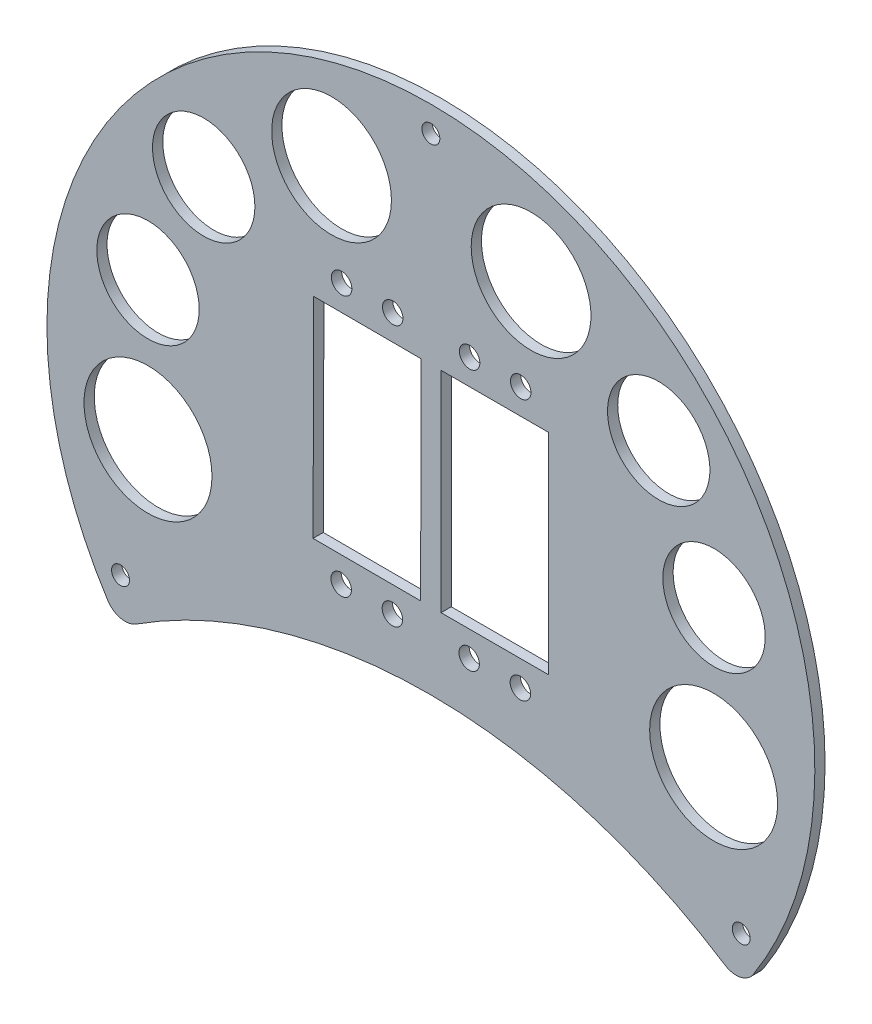
from build123d import *

# Parameters (mm, degrees)
EPAISSEUR_PLAQUE_DEPTH          = 2
ESQUISSE5_R                     = 1.75
PERCAGE_FIS_FIXATIONS_DEPTH     = 2
ARRONDIS_EXTREMITES_R           = 4
ESQUISSE10_R                    = 10
ESQUISSE10_R_2                  = 12.5
ESQUISSE10_R_3                  = 11.697835519
EVIDEMENT_DE_MATI_RE_DEPTH      = 2
ESQUISSE11_W                    = 21
ESQUISSE11_H                    = 41
ESQUISSE11_R                    = 2
EMPLACEMENTS_SERVOMOTEURS_DEPTH = 10


with BuildPart() as part:
    # Esquisse3 → Epaisseur plaque (new body)
    with BuildSketch(Plane.XY):
        with BuildLine():
            ThreePointArc((60.676831069, -44.083127967), (0.112789047, 74.999915191), (-60.809145642, -43.900430594))
            ThreePointArc((-60.809145642, -43.900430594), (-0.037511568, -24.943596323), (60.676831069, -44.083127967))
        make_face()
    extrude(amount=EPAISSEUR_PLAQUE_DEPTH)

    # Esquisse5 → Percage fis fixations (cut)
    with BuildSketch(Plane.XY.offset(2)):
        with Locations((0, 70)):
            Circle(ESQUISSE5_R)
        with Locations((60.621778265, -35)):
            Circle(ESQUISSE5_R)
        with Locations((-60.621778265, -35)):
            Circle(ESQUISSE5_R)
    extrude(amount=-PERCAGE_FIS_FIXATIONS_DEPTH, mode=Mode.SUBTRACT)

    # Arrondis extremites
    arrondis_extremites_edges = [part.edges().sort_by_distance(p)[0] for p in [
        (-60.809145642, -43.900430594, 1),
        (60.676831069, -44.083127967, 1),
    ]]
    fillet(arrondis_extremites_edges, radius=ARRONDIS_EXTREMITES_R)

    # Esquisse10 → Evidement de matière (cut)
    with BuildSketch(Plane.XY.offset(2)):
        with Locations((-44.375477733, 40.460370332)):
            Circle(ESQUISSE10_R)
        with Locations((-55.259118801, 17.647943075)):
            Circle(ESQUISSE10_R)
        with Locations((-55.259118801, -9.36594672)):
            Circle(ESQUISSE10_R_2)
        with Locations(Location((55.230698855, -9.532107458, 0), (0, 0, 180))):
            Circle(ESQUISSE10_R_2)
        with Locations(Location((55.311948653, 17.481660149, 0), (0, 0, 180))):
            Circle(ESQUISSE10_R)
        with Locations(Location((44.496969854, 40.326718999, 0), (0, 0, 180))):
            Circle(ESQUISSE10_R)
        with Locations((-19.404495621, 54.872818382)):
            Circle(ESQUISSE10_R_3)
        with Locations(Location((19.569449075, 54.814207195, 0), (0, 0, 180))):
            Circle(ESQUISSE10_R_3)
    extrude(amount=-EVIDEMENT_DE_MATI_RE_DEPTH, mode=Mode.SUBTRACT)

    # Esquisse11 → Emplacements servomoteurs (cut)
    with BuildSketch(Plane.XY.offset(2)):
        Polygon((-1.891789392, 30.96484727), (-2.015105277, -10.03496728), (-23.015010291, -9.971805486), (-22.891694406, 31.028009065), align=None)
        with Locations((12.484913946, 10.459017268)):
            Rectangle(ESQUISSE11_W, ESQUISSE11_H)
        with Locations((7.56186672, 35.974032472)):
            Circle(ESQUISSE11_R)
        with Locations((17.546338474, 35.959017268)):
            Circle(ESQUISSE11_R)
        with Locations((-7.453633256, 35.996613617)):
            Circle(ESQUISSE11_R)
        with Locations((-17.438105011, 36.011628821)):
            Circle(ESQUISSE11_R)
        with Locations((-17.522560101, -14.988347843)):
            Circle(ESQUISSE11_R)
        with Locations((17.477400322, -15.040982732)):
            Circle(ESQUISSE11_R)
        with Locations((7.47741163, -15.025944192)):
            Circle(ESQUISSE11_R)
        with Locations((-7.522571408, -15.003386383)):
            Circle(ESQUISSE11_R)
    extrude(amount=-EMPLACEMENTS_SERVOMOTEURS_DEPTH, mode=Mode.SUBTRACT)


solid = part.part
